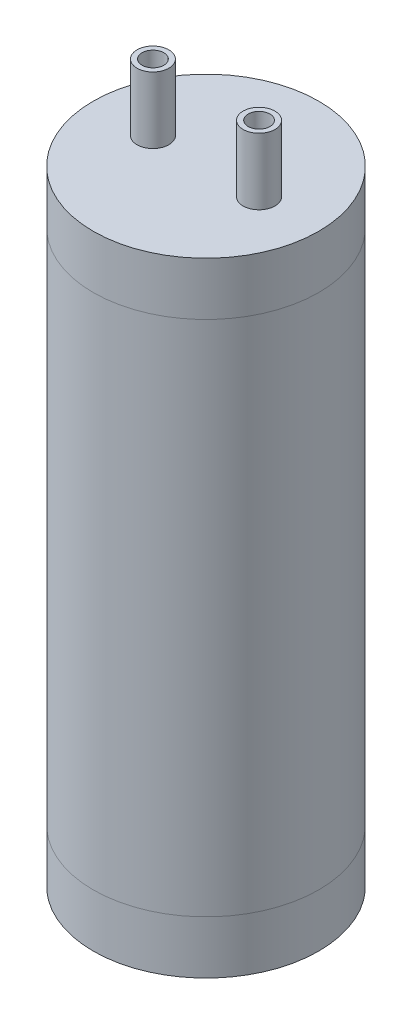
from build123d import *

# Parameters (mm, degrees)
VESSEL_D85_CATALOGUE_START                     = 20
SKETCH1_R                                      = 42.5
VESSEL_D85_CATALOGUE_DEPTH                     = 195
BOTTOM_HEAD_ENVELOPE_START                     = 20
SKETCH2_R                                      = 42.5
BOTTOM_HEAD_ENVELOPE_DEPTH                     = 20
TOP_HEAD_ENVELOPE_START                        = 215
SKETCH3_R                                      = 42.5
TOP_HEAD_ENVELOPE_DEPTH                        = 20
SKETCH4_R                                      = 4
M8_MOUNT_STUD_LENGTH_ASSUMED_DEPTH             = 8
INLET_ODS8_PROVISIONAL_POSITION_START          = 235
SKETCH5_R                                      = 6
SKETCH5_R_2                                    = 4.1
INLET_ODS8_PROVISIONAL_POSITION_DEPTH          = 25
LIQUID_OUTLET_DIP_TUBE_REQUIRED_ODS8_PRO_START = 235
SKETCH6_R                                      = 6
SKETCH6_R_2                                    = 4.1
LIQUID_OUTLET_DIP_TUBE_REQUIRED_ODS8_PRO_DEPTH = 25


with BuildPart() as part:
    # Sketch1 → Vessel_D85_catalogue (new body)
    with BuildSketch(Plane(origin=(0, 0, 0), x_dir=(1, 0, 0), z_dir=(0, 1, 0)).offset(VESSEL_D85_CATALOGUE_START)):
        with Locations(Location((0, 0, 0), (0, 0, 270))):
            Circle(SKETCH1_R)
    extrude(amount=VESSEL_D85_CATALOGUE_DEPTH)


with BuildPart() as body_2:
    # Sketch2 → Bottom_head_envelope (new body)
    with BuildSketch(Plane(origin=(0, 0, 0), x_dir=(1, 0, 0), z_dir=(0, 1, 0)).offset(BOTTOM_HEAD_ENVELOPE_START)):
        with Locations(Location((0, 0, 0), (0, 0, 270))):
            Circle(SKETCH2_R)
    extrude(amount=-BOTTOM_HEAD_ENVELOPE_DEPTH)


with BuildPart() as body_3:
    # Sketch3 → Top_head_envelope (new body)
    with BuildSketch(Plane(origin=(0, 0, 0), x_dir=(1, 0, 0), z_dir=(0, 1, 0)).offset(TOP_HEAD_ENVELOPE_START)):
        with Locations(Location((0, 0, 0), (0, 0, 270))):
            Circle(SKETCH3_R)
    extrude(amount=TOP_HEAD_ENVELOPE_DEPTH)


with BuildPart() as body_4:
    # Sketch4 → M8_mount_stud_length_assumed (new body)
    with BuildSketch(Plane(origin=(0, 0, 0), x_dir=(1, 0, 0), z_dir=(0, 1, 0))):
        with Locations(Location((0, 0, 0), (0, 0, 270))):
            Circle(SKETCH4_R)
    extrude(amount=-M8_MOUNT_STUD_LENGTH_ASSUMED_DEPTH)


with BuildPart() as body_5:
    # Sketch5 → Inlet_ODS8_provisional_position (new body)
    with BuildSketch(Plane(origin=(0, 0, 0), x_dir=(1, 0, 0), z_dir=(0, 1, 0)).offset(INLET_ODS8_PROVISIONAL_POSITION_START)):
        with Locations(Location((-20, 0, 0), (0, 0, 270))):
            Circle(SKETCH5_R)
        with Locations(Location((-20, 0, 0), (0, 0, 270))):
            Circle(SKETCH5_R_2, mode=Mode.SUBTRACT)
    extrude(amount=INLET_ODS8_PROVISIONAL_POSITION_DEPTH)


with BuildPart() as body_6:
    # Sketch6 → Liquid_outlet_dip_tube_required_ODS8_provisional_position (new body)
    with BuildSketch(Plane(origin=(0, 0, 0), x_dir=(1, 0, 0), z_dir=(0, 1, 0)).offset(LIQUID_OUTLET_DIP_TUBE_REQUIRED_ODS8_PRO_START)):
        with Locations(Location((20, 0, 0), (0, 0, 270))):
            Circle(SKETCH6_R)
        with Locations(Location((20, 0, 0), (0, 0, 270))):
            Circle(SKETCH6_R_2, mode=Mode.SUBTRACT)
    extrude(amount=LIQUID_OUTLET_DIP_TUBE_REQUIRED_ODS8_PRO_DEPTH)


solid = Compound([part.part, body_2.part, body_3.part, body_4.part, body_5.part, body_6.part])
